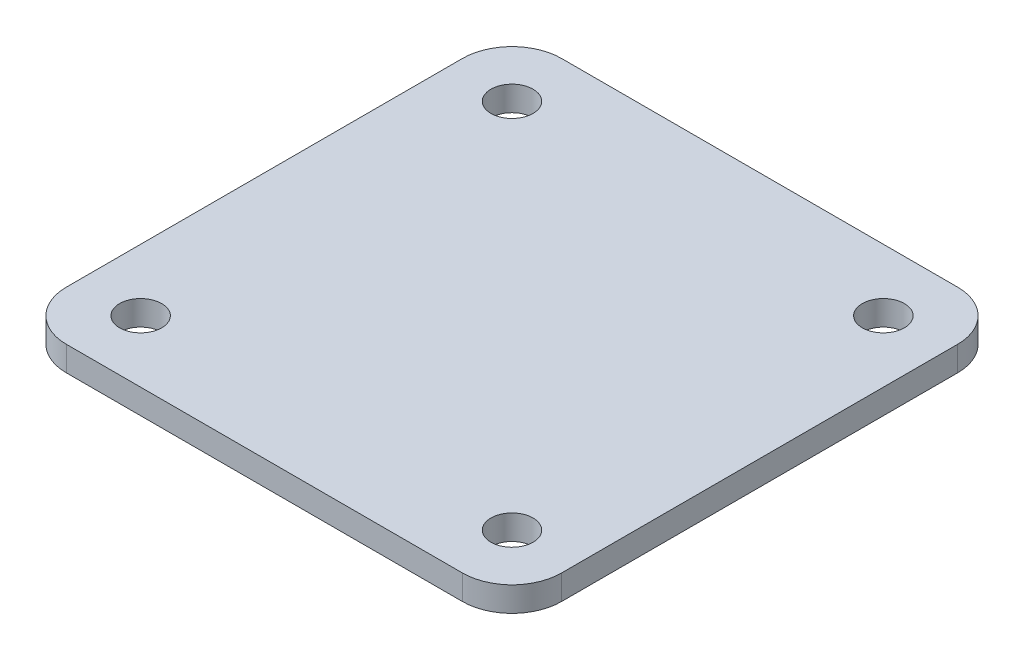
from build123d import *

# Parameters (mm, degrees)
SKETCH1_W           = 40
SKETCH1_H           = 40
BOSS_EXTRUDE1_DEPTH = 2
SKETCH2_R           = 1.7
CUT_EXTRUDE1_DEPTH  = 29.354893758
FILLET1_R           = 4


with BuildPart() as part:
    # Sketch1 → Boss-Extrude1 (new body)
    with BuildSketch(Plane(origin=(0, 0, 0), x_dir=(1, 0, 0), z_dir=(0, 1, 0))):
        Rectangle(SKETCH1_W, SKETCH1_H)
    extrude(amount=BOSS_EXTRUDE1_DEPTH)

    # Sketch2 → Cut-Extrude1 (cut, through all)
    with BuildSketch(Plane(origin=(0, 2, 0), x_dir=(1, 0, 0), z_dir=(0, 1, 0))):
        with Locations((15, 15)):
            Circle(SKETCH2_R)
        with Locations((15, -15)):
            Circle(SKETCH2_R)
        with Locations((-15, -15)):
            Circle(SKETCH2_R)
        with Locations((-15, 15)):
            Circle(SKETCH2_R)
    extrude(amount=-CUT_EXTRUDE1_DEPTH, mode=Mode.SUBTRACT)

    # Fillet1
    fillet1_edges = [part.edges().sort_by_distance(p)[0] for p in [
        (-20, 1, -20),
        (-20, 1, 20),
        (20, 1, 20),
        (20, 1, -20),
    ]]
    fillet(fillet1_edges, radius=FILLET1_R)


solid = part.part
